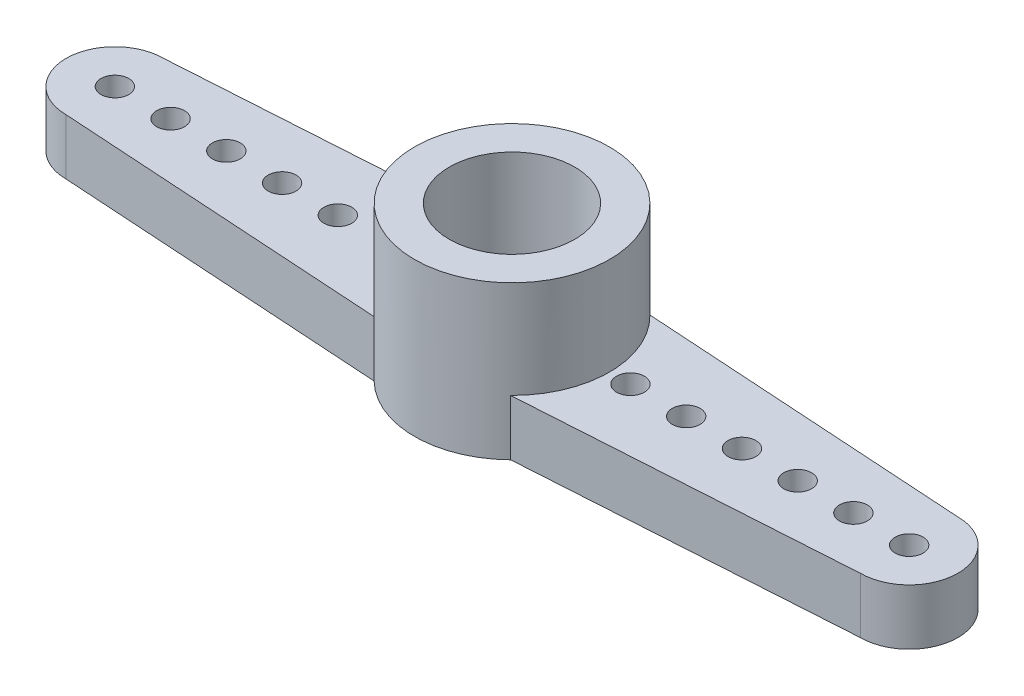
from build123d import *

# Parameters (mm, degrees)
BOSS_EXTRUDE1_DEPTH = 2
SKETCH2_R           = 3.5
SKETCH2_R_2         = 2.25
BOSS_EXTRUDE2_DEPTH = 3.5
SKETCH3_R           = 1.25
CUT_EXTRUDE1_DEPTH  = 5
SKETCH4_R           = 2.5
CUT_EXTRUDE2_DEPTH  = 1
SKETCH5_R           = 0.5
CUT_EXTRUDE3_DEPTH  = 5


with BuildPart() as part:
    # Sketch1 → Boss-Extrude1 (new body)
    with BuildSketch(Plane(origin=(0, 0, 0), x_dir=(1, 0, 0), z_dir=(0, 1, 0))):
        with BuildLine():
            Line((-14.25, 1.75), (-2.449489743, 2.5))
            ThreePointArc((-2.449489743, 2.5), (0, 3.5), (2.449489743, 2.5))
            Line((2.449489743, 2.5), (14.25, 1.75))
            ThreePointArc((14.25, 1.75), (16, 0), (14.25, -1.75))
            Line((14.25, -1.75), (2.449489743, -2.5))
            ThreePointArc((2.449489743, -2.5), (0, -3.5), (-2.449489743, -2.5))
            Line((-2.449489743, -2.5), (-14.25, -1.75))
            ThreePointArc((-14.25, -1.75), (-16, 0), (-14.25, 1.75))
        make_face()
    extrude(amount=BOSS_EXTRUDE1_DEPTH)

    # Sketch2 → Boss-Extrude2 (add)
    with BuildSketch(Plane(origin=(0, 2, 0), x_dir=(1, 0, 0), z_dir=(0, 1, 0))):
        Circle(SKETCH2_R)
        Circle(SKETCH2_R_2, mode=Mode.SUBTRACT)
    extrude(amount=BOSS_EXTRUDE2_DEPTH)

    # Sketch3 → Cut-Extrude1 (cut)
    with BuildSketch(Plane(origin=(0, 2, 0), x_dir=(1, 0, 0), z_dir=(0, 1, 0))):
        Circle(SKETCH3_R)
    extrude(amount=-CUT_EXTRUDE1_DEPTH, mode=Mode.SUBTRACT)

    # Sketch4 → Cut-Extrude2 (cut)
    with BuildSketch(Plane.XZ):
        Circle(SKETCH4_R)
    extrude(amount=-CUT_EXTRUDE2_DEPTH, mode=Mode.SUBTRACT)

    # Sketch5 → Cut-Extrude3 (cut)
    with BuildSketch(Plane.XZ):
        with Locations((14.25, 0)):
            Circle(SKETCH5_R)
        with Locations((12.25, 0)):
            Circle(SKETCH5_R)
        with Locations((10.25, 0)):
            Circle(SKETCH5_R)
        with Locations((8.25, 0)):
            Circle(SKETCH5_R)
        with Locations((6.25, 0)):
            Circle(SKETCH5_R)
        with Locations((4.25, 0)):
            Circle(SKETCH5_R)
        with Locations((-14.25, 0)):
            Circle(SKETCH5_R)
        with Locations((-12.25, 0)):
            Circle(SKETCH5_R)
        with Locations((-10.25, 0)):
            Circle(SKETCH5_R)
        with Locations((-8.25, 0)):
            Circle(SKETCH5_R)
        with Locations((-6.25, 0)):
            Circle(SKETCH5_R)
        with Locations((-4.25, 0)):
            Circle(SKETCH5_R)
    extrude(amount=-CUT_EXTRUDE3_DEPTH, mode=Mode.SUBTRACT)


solid = part.part
